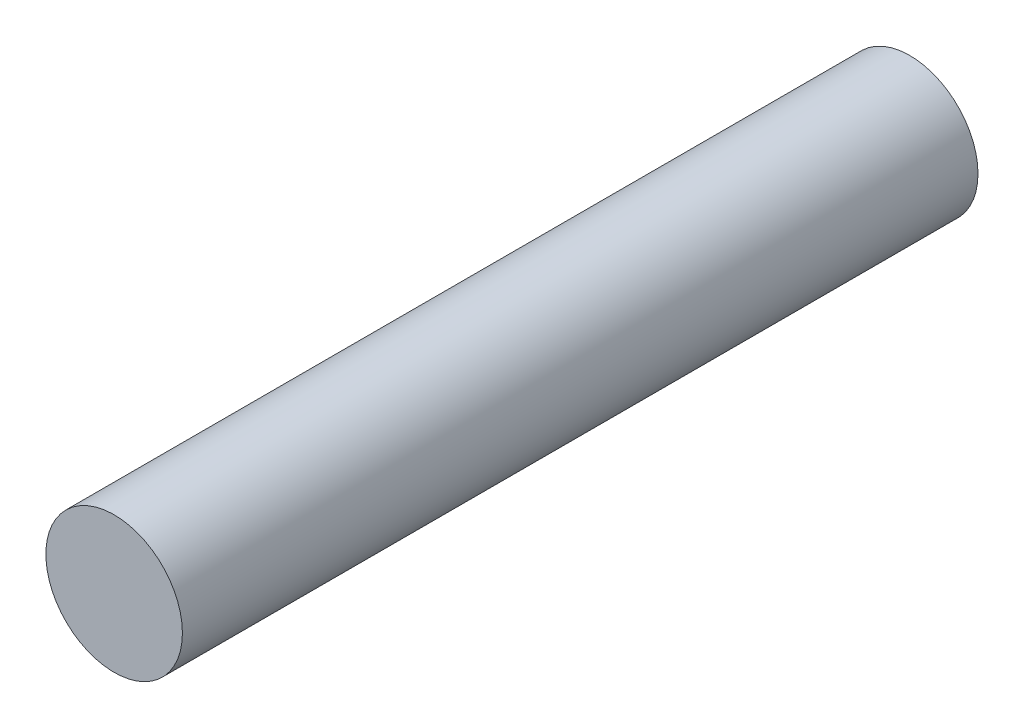
from build123d import *

# Parameters (mm, degrees)
CROQUIS1_R              = 3.175
SALIENTE_EXTRUIR1_DEPTH = 18.5


with BuildPart() as part:
    # Croquis1 → Saliente-Extruir1 (new, symmetric)
    with BuildSketch(Plane.XY):
        Circle(CROQUIS1_R)
    extrude(amount=SALIENTE_EXTRUIR1_DEPTH, both=True)


solid = part.part
